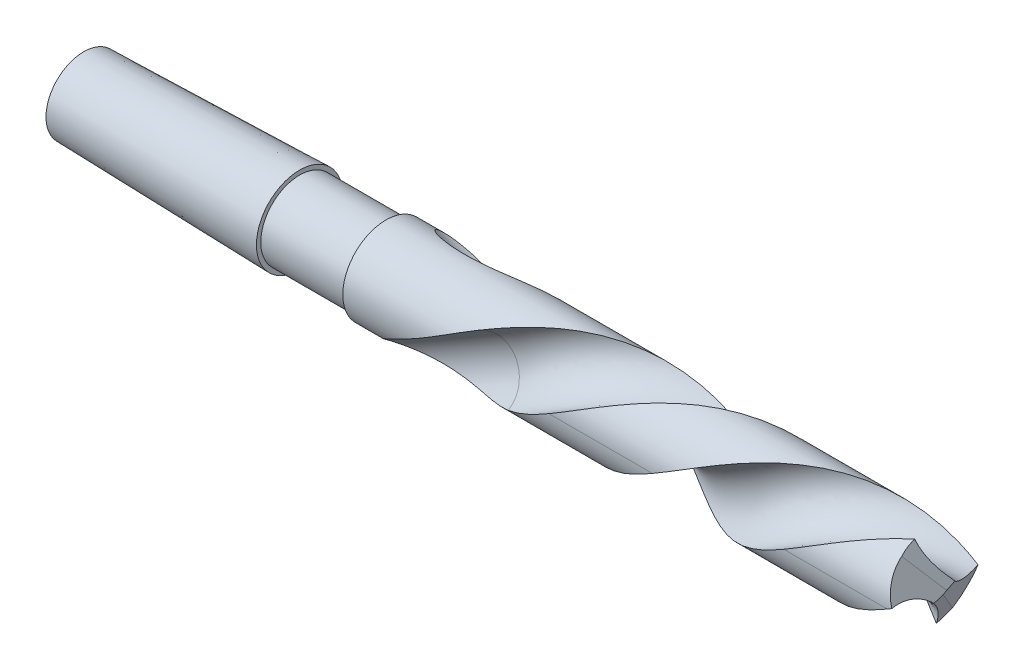
from build123d import *

# Parameters (mm, degrees)
KES_S_P_R2_PITCH        = 54.41398093
KES_S_P_R2_HEIGHT       = 60
KES_S_P_R2_RADIUS       = 5
IZIM5_R                 = 3.75
IZIM5_2_R               = 3.75
KES_EKSTR_ZYON3_DEPTH   = 68.485865375
DAIRESEL_KAPLAMA2_COUNT = 2
KES_EKSTR_ZYON4_DEPTH   = 10
KES_EKSTR_ZYON5_DEPTH   = 10
DAIRESEL_KAPLAMA3_COUNT = 2


with BuildPart() as part:
    # Çizim1 → Döndür2 (revolve)
    with BuildSketch(Plane.XY, mode=Mode.PRIVATE) as d_nd_r2_sk:
        Polygon((0, 0), (100, 0), (100, 5), (35, 5), (35, 4.5), (25, 4.5), (25, 5), (0, 4.37), align=None)
    revolve(d_nd_r2_sk.sketch.rotate(Axis((0, 0, 0), (1, 0, 0)), 90), axis=Axis((0, 0, 0), (1, 0, 0)))

    # Kes-Süpür2: sweep along a helix
    with BuildLine() as kes_s_p_r2_path:
        Helix(KES_S_P_R2_PITCH, KES_S_P_R2_HEIGHT, KES_S_P_R2_RADIUS, center=(51.25, 0, 0), direction=(1, 0, 0), lefthand=True)
    # Çizim5 → Kes-Süpür2 (sweep, cut)
    with BuildSketch(Plane(origin=(38.4375, 22.191900972, 0), x_dir=(0, 0, 1), z_dir=(-0.8660254037844364, -0.5000000000000041, 0))):
        with Locations((5, -25.625)):
            Circle(IZIM5_R)
    kes_s_p_r2 = sweep(path=kes_s_p_r2_path.line, is_frenet=True, mode=Mode.SUBTRACT)

    # Çizim5<2> → Kes-Ekstrüzyon3 (cut, through all)
    with BuildSketch(Plane(origin=(38.4375, 22.191900972, 0), x_dir=(0, 0, 1), z_dir=(-0.8660254037844364, -0.5000000000000041, 0))):
        with Locations((5, -25.625)):
            Circle(IZIM5_2_R)
    kes_ekstr_zyon3 = extrude(amount=KES_EKSTR_ZYON3_DEPTH, mode=Mode.SUBTRACT)

    # Dairesel Kaplama2: Kes-Süpür2, Kes-Ekstrüzyon3 ×2 about axis
    dairesel_kaplama2_axis = Axis((0, 0, 0), (-1, 0, 0))
    add([kes_s_p_r2.rotate(dairesel_kaplama2_axis, i * 360 / DAIRESEL_KAPLAMA2_COUNT) for i in range(1, DAIRESEL_KAPLAMA2_COUNT)], mode=Mode.SUBTRACT)
    add([kes_ekstr_zyon3.rotate(dairesel_kaplama2_axis, i * 360 / DAIRESEL_KAPLAMA2_COUNT) for i in range(1, DAIRESEL_KAPLAMA2_COUNT)], mode=Mode.SUBTRACT)

    # Çizim7 → Kes-Ekstrüzyon4 (cut, symmetric)
    with BuildSketch(Plane(origin=(0, 0, 0), x_dir=(-1, 0, 0), z_dir=(0, 0.6217868811999256, -0.7831864876053912))):
        Polygon((-110, 0), (-100, 0), (-95.857864376, 10), (-110, 10), align=None)
        Polygon((-110, -10), (-95.857864376, -10), (-100, 0), (-110, 0), align=None)
    extrude(amount=KES_EKSTR_ZYON4_DEPTH, both=True, mode=Mode.SUBTRACT)

    # Çizim8 → Kes-Ekstrüzyon5 (cut, symmetric)
    with BuildSketch(Plane(origin=(14.644660941, -27.689823816, -21.983486007), x_dir=(0, -0.6217868811999255, 0.7831864876053913), z_dir=(-0.38268343236509406, 0.7235699660380243, 0.5744561731246371))):
        Polygon((-5, 92.405967964), (5, 92.405967964), (-0.224007862, 92.132189313), (-5, 91.290053039), align=None)
    kes_ekstr_zyon5 = extrude(amount=KES_EKSTR_ZYON5_DEPTH, both=True, mode=Mode.SUBTRACT)

    # Dairesel Kaplama3: Kes-Ekstrüzyon5 ×2 about axis
    dairesel_kaplama3_axis = Axis((0, 0, 0), (1, 0, 0))
    for i in range(1, DAIRESEL_KAPLAMA3_COUNT):
        add(kes_ekstr_zyon5.rotate(dairesel_kaplama3_axis, i * 360 / DAIRESEL_KAPLAMA3_COUNT), mode=Mode.SUBTRACT)


solid = part.part
